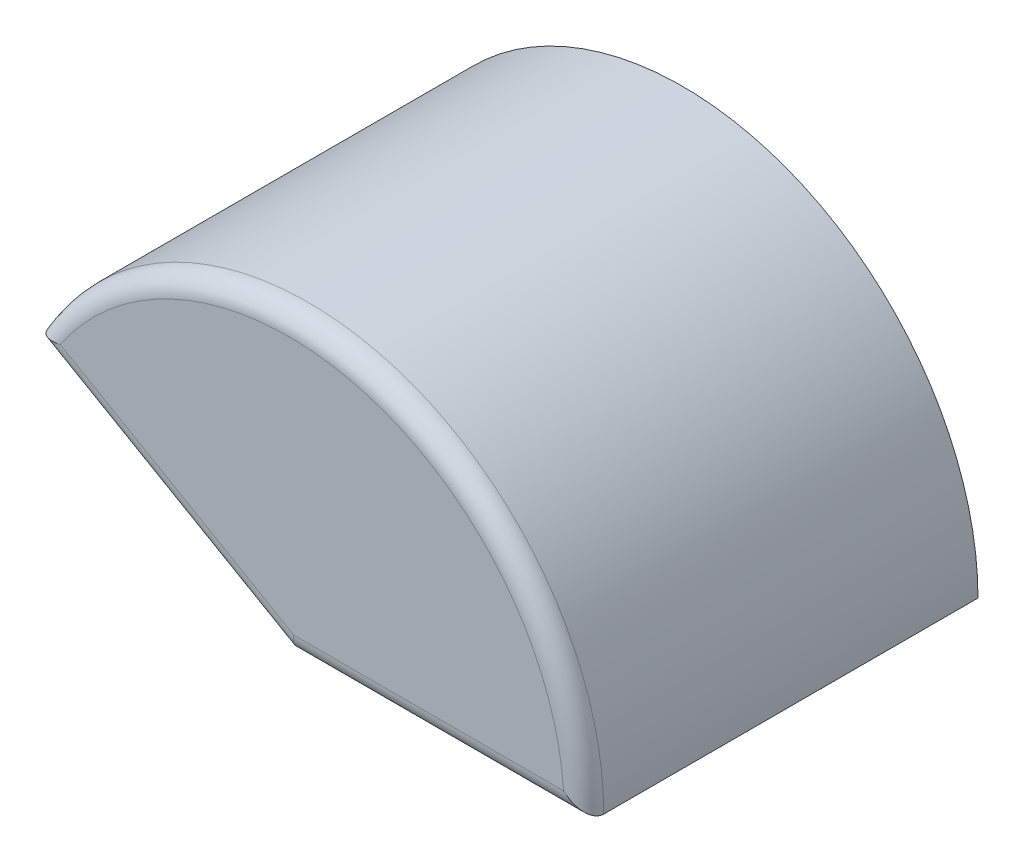
from build123d import *

# Parameters (mm, degrees)
BOSS_EXTRUDE1_DEPTH = 40
FILLET1_R           = 2


with BuildPart() as part:
    # Sketch1 → Boss-Extrude1 (new body)
    with BuildSketch(Plane.XY):
        with BuildLine():
            Line((-25.980762114, 15), (0, 0))
            Line((0, 0), (30, 0))
            ThreePointArc((30, 0), (7.764571353, 28.977774789), (-25.980762114, 15))
        make_face()
    extrude(amount=BOSS_EXTRUDE1_DEPTH)

    # Fillet1
    fillet1_edges = [part.edges().sort_by_distance(p)[0] for p in [
        (-12.990381057, 7.5, 40),
        (15, 0, 40),
        (7.764571353, 28.977774789, 40),
    ]]
    fillet(fillet1_edges, radius=FILLET1_R)


solid = part.part
